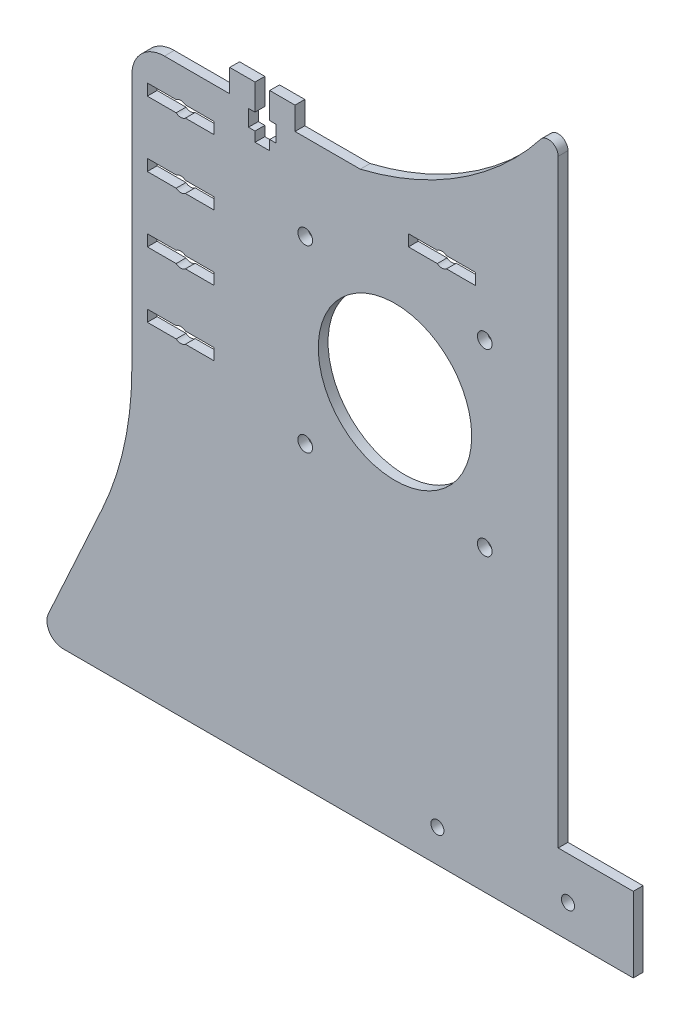
from build123d import *

# Parameters (mm, degrees)
SKETCH_1_R          = 2
SKETCH_1_R_2        = 23.5
EXTRUDE_1_DEPTH     = 3
SKETCH_2_R          = 2.25
CUT_EXTRUDE_1_DEPTH = 162.687369417
FILLET_1_R          = 10
FILLET_2_R          = 100
FILLET_3_R          = 5
SKETCH_3_W          = 20
SKETCH_3_H          = 7
EXTRUDE_2_DEPTH     = 3
CUT_EXTRUDE_2_DEPTH = 10
FILLET_4_R          = 3
CUT_EXTRUDE_3_DEPTH = 3
CUT_EXTRUDE_START   = -10
CUT_EXTRUDE_4_DEPTH = 10


with BuildPart() as part:
    # 草图1 → 凸台-拉伸1 (new body)
    # profile 1 of 3: a face of its own
    with BuildSketch(Plane.XY):
        with BuildLine():
            Line((-80.627893842, 53.795936885), (-80.627893842, -56.059432026))
            Line((-80.627893842, -56.059432026), (-109.420315431, -119))
            Line((-109.420315431, -119), (50, -119))
            Line((50, -119), (73, -119))
            Line((73, -119), (73, -96))
            Line((73, -96), (50, -96))
            Line((50, -96), (50, 0))
            ThreePointArc((50, 0), (-22.925467429, -44.434479216), (-28.976917727, 40.747248239))
            Line((-28.976917727, 40.747248239), (-10.627893842, 53.795936885))
            Line((-10.627893842, 53.795936885), (-80.627893842, 53.795936885))
        make_face()
        with BuildLine():
            Line((-66.950769498, -19.204063115), (-75.627893842, -19.204063115))
            Line((-75.627893842, -19.204063115), (-75.627893842, -16.204063115))
            Line((-75.627893842, -16.204063115), (-66.950769498, -16.204063115))
            ThreePointArc((-66.950769498, -16.204063115), (-65.627893842, -15.704063115), (-64.305018187, -16.204063115))
            Line((-64.305018187, -16.204063115), (-55.627893842, -16.204063115))
            Line((-55.627893842, -16.204063115), (-55.627893842, -19.204063115))
            Line((-55.627893842, -19.204063115), (-64.305018187, -19.204063115))
            ThreePointArc((-64.305018187, -19.204063115), (-65.627893842, -19.704063115), (-66.950769498, -19.204063115))
        make_face(mode=Mode.SUBTRACT)
        with Locations((13, -109)):
            Circle(SKETCH_1_R, mode=Mode.SUBTRACT)
        with Locations((53, -109.000000002)):
            Circle(SKETCH_1_R, mode=Mode.SUBTRACT)
        with BuildLine():
            Line((-66.950769498, 0.795936885), (-75.627893842, 0.795936885))
            Line((-75.627893842, 0.795936885), (-75.627893842, 3.795936885))
            Line((-75.627893842, 3.795936885), (-66.950769498, 3.795936885))
            ThreePointArc((-66.950769498, 3.795936885), (-65.627893842, 4.295936885), (-64.305018187, 3.795936885))
            Line((-64.305018187, 3.795936885), (-55.627893842, 3.795936885))
            Line((-55.627893842, 3.795936885), (-55.627893842, 0.795936885))
            Line((-55.627893842, 0.795936885), (-64.305018187, 0.795936885))
            ThreePointArc((-64.305018187, 0.795936885), (-65.627893842, 0.295936885), (-66.950769498, 0.795936885))
        make_face(mode=Mode.SUBTRACT)
        with BuildLine():
            Line((-66.950769498, 20.795936885), (-75.627893842, 20.795936885))
            Line((-75.627893842, 20.795936885), (-75.627893842, 23.795936885))
            Line((-75.627893842, 23.795936885), (-66.950769498, 23.795936885))
            ThreePointArc((-66.950769498, 23.795936885), (-65.627893842, 24.295936885), (-64.305018187, 23.795936885))
            Line((-64.305018187, 23.795936885), (-55.627893842, 23.795936885))
            Line((-55.627893842, 23.795936885), (-55.627893842, 20.795936885))
            Line((-55.627893842, 20.795936885), (-64.305018187, 20.795936885))
            ThreePointArc((-64.305018187, 20.795936885), (-65.627893842, 20.295936885), (-66.950769498, 20.795936885))
        make_face(mode=Mode.SUBTRACT)
        with BuildLine():
            Line((-55.627893842, 40.795936885), (-64.305018187, 40.795936885))
            ThreePointArc((-64.305018187, 40.795936885), (-65.627893842, 40.295936885), (-66.950769498, 40.795936885))
            Line((-66.950769498, 40.795936885), (-75.627893842, 40.795936885))
            Line((-75.627893842, 40.795936885), (-75.627893842, 43.795936885))
            Line((-75.627893842, 43.795936885), (-66.950769498, 43.795936885))
            ThreePointArc((-66.950769498, 43.795936885), (-65.627893842, 44.295936885), (-64.305018187, 43.795936885))
            Line((-64.305018187, 43.795936885), (-55.627893842, 43.795936885))
            Line((-55.627893842, 43.795936885), (-55.627893842, 40.795936885))
        make_face(mode=Mode.SUBTRACT)
    # profile 2 of 3: a face of its own
    with BuildSketch(Plane.XY):
        with BuildLine():
            ThreePointArc((50, 96.910737705), (23.844670052, 69.505503521), (-10.627893842, 53.795936885))
            Line((-10.627893842, 53.795936885), (-28.976917727, 40.747248239))
            ThreePointArc((-28.976917727, 40.747248239), (22.925467429, 44.434479216), (50, 0))
            Line((50, 0), (50, 96.910737705))
        make_face()
    # profile 3 of 3: a face of its own
    with BuildSketch(Plane.XY):
        with BuildLine():
            ThreePointArc((50, 0), (22.925467429, 44.434479216), (-28.976917727, 40.747248239))
            ThreePointArc((-28.976917727, 40.747248239), (-22.925467429, -44.434479216), (50, 0))
        make_face()
        Circle(SKETCH_1_R_2, mode=Mode.SUBTRACT)
    extrude(amount=EXTRUDE_1_DEPTH)

    # 草图2 → 切除-拉伸1 (cut, through all)
    with BuildSketch(Plane.XY.offset(3)):
        with Locations((-27.5, 27.5)):
            Circle(SKETCH_2_R)
        with Locations((27.5, 27.5)):
            Circle(SKETCH_2_R)
        with Locations((27.5, -27.5)):
            Circle(SKETCH_2_R)
        with Locations((-27.5, -27.5)):
            Circle(SKETCH_2_R)
    extrude(amount=-CUT_EXTRUDE_1_DEPTH, mode=Mode.SUBTRACT)

    # 圆角1
    fillet_1_edges = [part.edges().sort_by_distance(p)[0] for p in [
        (-80.627893842, 53.795936885, 1.5),
    ]]
    fillet(fillet_1_edges, radius=FILLET_1_R)

    # 圆角2
    fillet_2_edges = [part.edges().sort_by_distance(p)[0] for p in [
        (-80.627893842, -56.059432026, 1.5),
    ]]
    fillet(fillet_2_edges, radius=FILLET_2_R)

    # 圆角3
    fillet_3_edges = [part.edges().sort_by_distance(p)[0] for p in [
        (-109.420315431, -119, 1.5),
    ]]
    fillet(fillet_3_edges, radius=FILLET_3_R)

    # 草图3 → 凸台-拉伸2 (add)
    with BuildSketch(Plane.XY.offset(3)):
        with Locations((-40.627893842, 57.295936885)):
            Rectangle(SKETCH_3_W, SKETCH_3_H)
    extrude(amount=-EXTRUDE_2_DEPTH)

    # 草图4 → 切除-拉伸2 (cut)
    with BuildSketch(Plane.XY.offset(3)):
        with BuildLine():
            Line((15.694981813, 43.795936885), (13.049230502, 43.795936885))
            ThreePointArc((13.049230502, 43.795936885), (12.372106158, 42.295936885), (13.049230502, 40.795936885))
            Line((13.049230502, 40.795936885), (15.694981813, 40.795936885))
            ThreePointArc((15.694981813, 40.795936885), (16.194981813, 41.47306123), (16.372106158, 42.295936885))
            ThreePointArc((16.372106158, 42.295936885), (16.194981813, 43.118812541), (15.694981813, 43.795936885))
        make_face()
        with BuildLine():
            ThreePointArc((15.694981813, 43.795936885), (14.372106158, 44.295936885), (13.049230502, 43.795936885))
            Line((13.049230502, 43.795936885), (15.694981813, 43.795936885))
        make_face()
        with BuildLine():
            Line((15.694981813, 40.795936885), (13.049230502, 40.795936885))
            ThreePointArc((13.049230502, 40.795936885), (14.372106158, 40.295936885), (15.694981813, 40.795936885))
        make_face()
        with BuildLine():
            Line((24.372106158, 43.795936885), (15.694981813, 43.795936885))
            ThreePointArc((15.694981813, 43.795936885), (16.194981813, 43.118812541), (16.372106158, 42.295936885))
            ThreePointArc((16.372106158, 42.295936885), (16.194981813, 41.47306123), (15.694981813, 40.795936885))
            Line((15.694981813, 40.795936885), (24.372106158, 40.795936885))
            Line((24.372106158, 40.795936885), (24.372106158, 43.795936885))
        make_face()
        with BuildLine():
            Line((13.049230502, 43.795936885), (4.372106158, 43.795936885))
            Line((4.372106158, 43.795936885), (4.372106158, 40.795936885))
            Line((4.372106158, 40.795936885), (13.049230502, 40.795936885))
            ThreePointArc((13.049230502, 40.795936885), (12.372106158, 42.295936885), (13.049230502, 43.795936885))
        make_face()
    extrude(amount=-CUT_EXTRUDE_2_DEPTH, mode=Mode.SUBTRACT)

    # 圆角4
    fillet_4_edges = [part.edges().sort_by_distance(p)[0] for p in [
        (50, 96.910737705, 1.5),
    ]]
    fillet(fillet_4_edges, radius=FILLET_4_R)

    # 草图5 → 切除-拉伸3 (cut)
    with BuildSketch(Plane.XY.offset(3)):
        Polygon((-42.877893842, 60.795936885), (-42.877893842, 52.795936885), (-44.877893842, 52.795936885), (-44.877893842, 47.795936885), (-42.877893842, 47.795936885), (-42.877893842, 44.795936885), (-38.377893842, 44.795936885), (-38.377893842, 47.795936885), (-36.377893842, 47.795936885), (-36.377893842, 52.795936885), (-38.377893842, 52.795936885), (-38.377893842, 60.795936885), align=None)
    extrude(amount=-CUT_EXTRUDE_3_DEPTH, mode=Mode.SUBTRACT)

    # 草图7 → 切除-拉伸4 (cut)
    # profile 1 of 5: a face of its own
    with BuildSketch(Plane.XY.offset(3).offset(CUT_EXTRUDE_START)):
        with BuildLine():
            Line((-75.877893842, 44.045936885), (-67.042107404, 44.045936885))
            ThreePointArc((-67.042107404, 44.045936885), (-65.627893842, 44.545936885), (-64.21368028, 44.045936885))
            Line((-64.21368028, 44.045936885), (-55.377893842, 44.045936885))
            Line((-55.377893842, 44.045936885), (-55.377893842, 40.545936885))
            Line((-55.377893842, 40.545936885), (-64.21368028, 40.545936885))
            ThreePointArc((-64.21368028, 40.545936885), (-65.627893842, 40.045936885), (-67.042107404, 40.545936885))
            Line((-67.042107404, 40.545936885), (-75.877893842, 40.545936885))
            Line((-75.877893842, 40.545936885), (-75.877893842, 44.045936885))
        make_face()
        with BuildLine():
            Line((-64.305018187, 43.795936885), (-55.627893842, 43.795936885))
            Line((-55.627893842, 43.795936885), (-55.627893842, 40.795936885))
            Line((-55.627893842, 40.795936885), (-64.305018187, 40.795936885))
            ThreePointArc((-64.305018187, 40.795936885), (-65.627893842, 40.295936885), (-66.950769498, 40.795936885))
            Line((-66.950769498, 40.795936885), (-75.627893842, 40.795936885))
            Line((-75.627893842, 40.795936885), (-75.627893842, 43.795936885))
            Line((-75.627893842, 43.795936885), (-66.950769498, 43.795936885))
            ThreePointArc((-66.950769498, 43.795936885), (-65.627893842, 44.295936885), (-64.305018187, 43.795936885))
        make_face(mode=Mode.SUBTRACT)
    # profile 2 of 5: a face of its own
    with BuildSketch(Plane.XY.offset(3).offset(CUT_EXTRUDE_START)):
        with BuildLine():
            Line((-75.877893842, 24.045936885), (-75.877893842, 20.545936885))
            Line((-75.877893842, 20.545936885), (-67.042107404, 20.545936885))
            ThreePointArc((-67.042107404, 20.545936885), (-65.627893842, 20.045936885), (-64.21368028, 20.545936885))
            Line((-64.21368028, 20.545936885), (-55.377893842, 20.545936885))
            Line((-55.377893842, 20.545936885), (-55.377893842, 24.045936885))
            Line((-55.377893842, 24.045936885), (-64.21368028, 24.045936885))
            ThreePointArc((-64.21368028, 24.045936885), (-65.627893842, 24.545936885), (-67.042107404, 24.045936885))
            Line((-67.042107404, 24.045936885), (-75.877893842, 24.045936885))
        make_face()
        with BuildLine():
            Line((-75.627893842, 23.795936885), (-75.627893842, 20.795936885))
            Line((-75.627893842, 20.795936885), (-66.950769498, 20.795936885))
            ThreePointArc((-66.950769498, 20.795936885), (-65.627893842, 20.295936885), (-64.305018187, 20.795936885))
            Line((-64.305018187, 20.795936885), (-55.627893842, 20.795936885))
            Line((-55.627893842, 20.795936885), (-55.627893842, 23.795936885))
            Line((-55.627893842, 23.795936885), (-64.305018187, 23.795936885))
            ThreePointArc((-64.305018187, 23.795936885), (-65.627893842, 24.295936885), (-66.950769498, 23.795936885))
            Line((-66.950769498, 23.795936885), (-75.627893842, 23.795936885))
        make_face(mode=Mode.SUBTRACT)
    # profile 3 of 5: a face of its own
    with BuildSketch(Plane.XY.offset(3).offset(CUT_EXTRUDE_START)):
        with BuildLine():
            Line((-75.877893842, 4.045936885), (-75.877893842, 0.545936885))
            Line((-75.877893842, 0.545936885), (-67.042107404, 0.545936885))
            ThreePointArc((-67.042107404, 0.545936885), (-65.627893842, 0.045936885), (-64.21368028, 0.545936885))
            Line((-64.21368028, 0.545936885), (-55.377893842, 0.545936885))
            Line((-55.377893842, 0.545936885), (-55.377893842, 4.045936885))
            Line((-55.377893842, 4.045936885), (-64.21368028, 4.045936885))
            ThreePointArc((-64.21368028, 4.045936885), (-65.627893842, 4.545936885), (-67.042107404, 4.045936885))
            Line((-67.042107404, 4.045936885), (-75.877893842, 4.045936885))
        make_face()
        with BuildLine():
            Line((-75.627893842, 3.795936885), (-75.627893842, 0.795936885))
            Line((-75.627893842, 0.795936885), (-66.950769498, 0.795936885))
            ThreePointArc((-66.950769498, 0.795936885), (-65.627893842, 0.295936885), (-64.305018187, 0.795936885))
            Line((-64.305018187, 0.795936885), (-55.627893842, 0.795936885))
            Line((-55.627893842, 0.795936885), (-55.627893842, 3.795936885))
            Line((-55.627893842, 3.795936885), (-64.305018187, 3.795936885))
            ThreePointArc((-64.305018187, 3.795936885), (-65.627893842, 4.295936885), (-66.950769498, 3.795936885))
            Line((-66.950769498, 3.795936885), (-75.627893842, 3.795936885))
        make_face(mode=Mode.SUBTRACT)
    # profile 4 of 5: a face of its own
    with BuildSketch(Plane.XY.offset(3).offset(CUT_EXTRUDE_START)):
        with BuildLine():
            Line((-75.877893842, -19.454063115), (-67.042107404, -19.454063115))
            ThreePointArc((-67.042107404, -19.454063115), (-65.627893842, -19.954063115), (-64.21368028, -19.454063115))
            Line((-64.21368028, -19.454063115), (-55.377893842, -19.454063115))
            Line((-55.377893842, -19.454063115), (-55.377893842, -15.954063115))
            Line((-55.377893842, -15.954063115), (-64.21368028, -15.954063115))
            ThreePointArc((-64.21368028, -15.954063115), (-65.627893842, -15.454063115), (-67.042107404, -15.954063115))
            Line((-67.042107404, -15.954063115), (-75.877893842, -15.954063115))
            Line((-75.877893842, -15.954063115), (-75.877893842, -19.454063115))
        make_face()
        with BuildLine():
            Line((-75.627893842, -19.204063115), (-66.950769498, -19.204063115))
            ThreePointArc((-66.950769498, -19.204063115), (-65.627893842, -19.704063115), (-64.305018187, -19.204063115))
            Line((-64.305018187, -19.204063115), (-55.627893842, -19.204063115))
            Line((-55.627893842, -19.204063115), (-55.627893842, -16.204063115))
            Line((-55.627893842, -16.204063115), (-64.305018187, -16.204063115))
            ThreePointArc((-64.305018187, -16.204063115), (-65.627893842, -15.704063115), (-66.950769498, -16.204063115))
            Line((-66.950769498, -16.204063115), (-75.627893842, -16.204063115))
            Line((-75.627893842, -16.204063115), (-75.627893842, -19.204063115))
        make_face(mode=Mode.SUBTRACT)
    # profile 5 of 5: a face of its own
    with BuildSketch(Plane.XY.offset(3).offset(CUT_EXTRUDE_START)):
        with BuildLine():
            Line((4.122106158, 44.045936885), (4.122106158, 40.545936885))
            Line((4.122106158, 40.545936885), (12.957892596, 40.545936885))
            ThreePointArc((12.957892596, 40.545936885), (14.372106158, 40.045936885), (15.78631972, 40.545936885))
            Line((15.78631972, 40.545936885), (24.622106158, 40.545936885))
            Line((24.622106158, 40.545936885), (24.622106158, 44.045936885))
            Line((24.622106158, 44.045936885), (15.78631972, 44.045936885))
            ThreePointArc((15.78631972, 44.045936885), (14.372106158, 44.545936885), (12.957892596, 44.045936885))
            Line((12.957892596, 44.045936885), (4.122106158, 44.045936885))
        make_face()
        with BuildLine():
            Line((4.372106158, 43.795936885), (4.372106158, 40.795936885))
            Line((4.372106158, 40.795936885), (13.049230502, 40.795936885))
            ThreePointArc((13.049230502, 40.795936885), (14.372106158, 40.295936885), (15.694981813, 40.795936885))
            Line((15.694981813, 40.795936885), (24.372106158, 40.795936885))
            Line((24.372106158, 40.795936885), (24.372106158, 43.795936885))
            Line((24.372106158, 43.795936885), (15.694981813, 43.795936885))
            ThreePointArc((15.694981813, 43.795936885), (14.372106158, 44.295936885), (13.049230502, 43.795936885))
            Line((13.049230502, 43.795936885), (4.372106158, 43.795936885))
        make_face(mode=Mode.SUBTRACT)
    extrude(amount=CUT_EXTRUDE_4_DEPTH, mode=Mode.SUBTRACT)


solid = part.part
